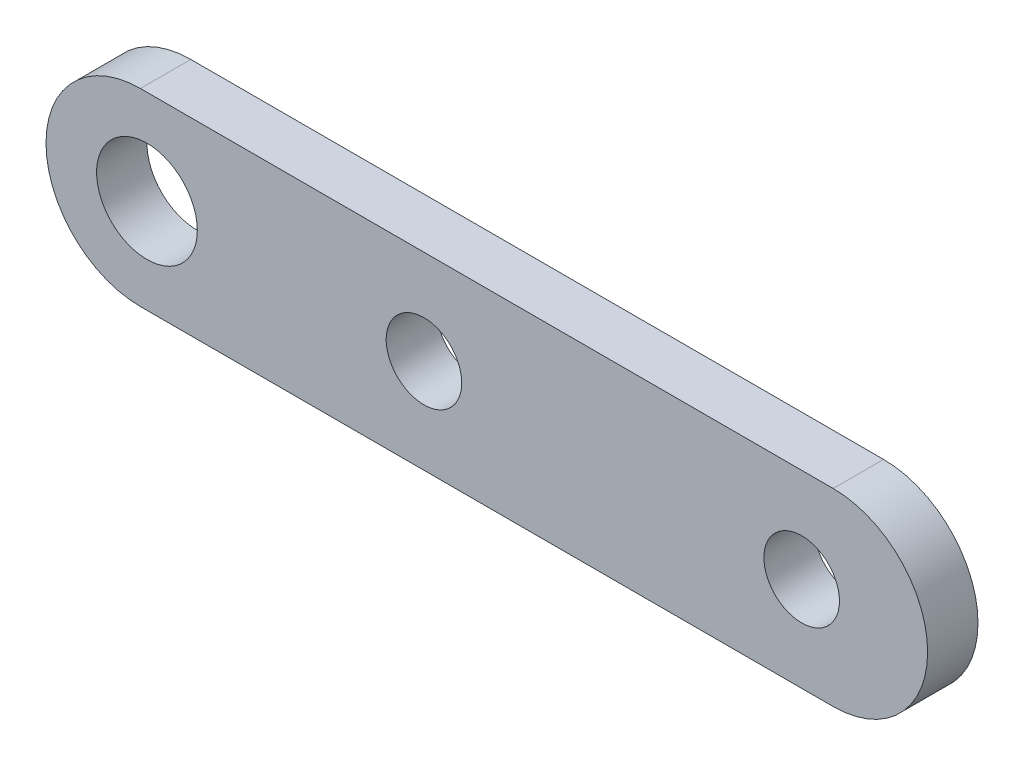
from build123d import *

# Parameters (mm, degrees)
EXTRUDE_1_DEPTH     = 4
SKETCH_2_R          = 4
SKETCH_2_R_2        = 3
CUT_EXTRUDE_1_DEPTH = 4


with BuildPart() as part:
    # Эскиз1 → Бобышка-Вытянуть1 (new body)
    with BuildSketch(Plane.XY):
        with BuildLine():
            Line((7.483128905, 0), (62.502687585, 0))
            ThreePointArc((62.502687585, 0), (70.002687585, 7.5), (62.502687585, 15))
            Line((62.502687585, 15), (7.483128905, 15))
            ThreePointArc((7.483128905, 15), (-0.016871095, 7.5), (7.483128905, 0))
        make_face()
    extrude(amount=EXTRUDE_1_DEPTH)

    # Эскиз2 → Вырез-Вытянуть1 (cut)
    with BuildSketch(Plane.XY.offset(4)):
        with Locations((8, 7.5)):
            Circle(SKETCH_2_R)
        with Locations((30, 7.5)):
            Circle(SKETCH_2_R_2)
        with Locations((60, 7.5)):
            Circle(SKETCH_2_R_2)
    extrude(amount=-CUT_EXTRUDE_1_DEPTH, mode=Mode.SUBTRACT)


solid = part.part
